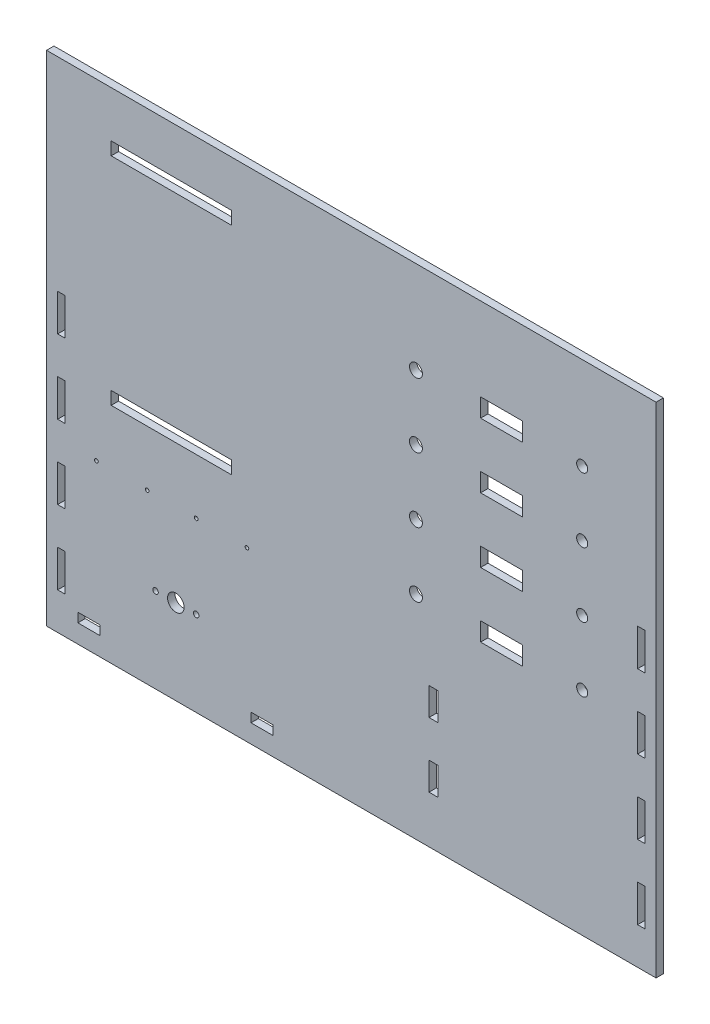
from build123d import *

# Parameters (mm, degrees)
SCHIZZO1_W                   = 330
SCHIZZO1_H                   = 270
SCHIZZO1_R                   = 3.5
SCHIZZO1_R_2                 = 1
SCHIZZO1_R_3                 = 3
SCHIZZO1_R_4                 = 4.5
SCHIZZO1_R_5                 = 1.5
SCHIZZO1_W_2                 = 22.7
SCHIZZO1_H_2                 = 10
SCHIZZO1_W_3                 = 65
SCHIZZO1_H_3                 = 7
SCHIZZO1_W_4                 = 4
SCHIZZO1_H_4                 = 20
SCHIZZO1_W_5                 = 5
SCHIZZO1_H_5                 = 15
SCHIZZO1_W_6                 = 12
SCHIZZO1_H_6                 = 5
ESTRUSIONE_ESTRUSIONE1_DEPTH = 4


with BuildPart() as part:
    # Schizzo1 → Estrusione-Estrusione1 (new body)
    with BuildSketch(Plane.XY):
        with Locations((165, 135)):
            Rectangle(SCHIZZO1_W, SCHIZZO1_H)
        with Locations((200, 220)):
            Circle(SCHIZZO1_R, mode=Mode.SUBTRACT)
        with Locations((200, 185)):
            Circle(SCHIZZO1_R, mode=Mode.SUBTRACT)
        with Locations((200, 150)):
            Circle(SCHIZZO1_R, mode=Mode.SUBTRACT)
        with Locations((200, 115)):
            Circle(SCHIZZO1_R, mode=Mode.SUBTRACT)
        with Locations((27, 91)):
            Circle(SCHIZZO1_R_2, mode=Mode.SUBTRACT)
        with Locations((54.5, 91)):
            Circle(SCHIZZO1_R_2, mode=Mode.SUBTRACT)
        with Locations((81, 91)):
            Circle(SCHIZZO1_R_2, mode=Mode.SUBTRACT)
        with Locations((108.5, 91)):
            Circle(SCHIZZO1_R_2, mode=Mode.SUBTRACT)
        with Locations((290, 220)):
            Circle(SCHIZZO1_R_3, mode=Mode.SUBTRACT)
        with Locations((290, 185)):
            Circle(SCHIZZO1_R_3, mode=Mode.SUBTRACT)
        with Locations((290, 150)):
            Circle(SCHIZZO1_R_3, mode=Mode.SUBTRACT)
        with Locations((290, 115)):
            Circle(SCHIZZO1_R_3, mode=Mode.SUBTRACT)
        with Locations((70, 46)):
            Circle(SCHIZZO1_R_4, mode=Mode.SUBTRACT)
        with Locations((59, 46)):
            Circle(SCHIZZO1_R_5, mode=Mode.SUBTRACT)
        with Locations((81, 46)):
            Circle(SCHIZZO1_R_5, mode=Mode.SUBTRACT)
        with Locations((246.35, 185)):
            Rectangle(SCHIZZO1_W_2, SCHIZZO1_H_2, mode=Mode.SUBTRACT)
        with Locations((67.5, 241.5)):
            Rectangle(SCHIZZO1_W_3, SCHIZZO1_H_3, mode=Mode.SUBTRACT)
        with Locations((246.35, 220)):
            Rectangle(SCHIZZO1_W_2, SCHIZZO1_H_2, mode=Mode.SUBTRACT)
        with Locations((246.35, 150)):
            Rectangle(SCHIZZO1_W_2, SCHIZZO1_H_2, mode=Mode.SUBTRACT)
        with Locations((246.35, 115)):
            Rectangle(SCHIZZO1_W_2, SCHIZZO1_H_2, mode=Mode.SUBTRACT)
        with Locations((8, 110)):
            Rectangle(SCHIZZO1_W_4, SCHIZZO1_H_4, mode=Mode.SUBTRACT)
        with Locations((67.5, 124.5)):
            Rectangle(SCHIZZO1_W_3, SCHIZZO1_H_3, mode=Mode.SUBTRACT)
        with Locations((209.563268788, 68.177868744)):
            Rectangle(SCHIZZO1_W_5, SCHIZZO1_H_5, mode=Mode.SUBTRACT)
        with Locations((22.947077827, 12.5)):
            Rectangle(SCHIZZO1_W_6, SCHIZZO1_H_6, mode=Mode.SUBTRACT)
        with Locations((116.687234465, 12.5)):
            Rectangle(SCHIZZO1_W_6, SCHIZZO1_H_6, mode=Mode.SUBTRACT)
        with Locations((209.563268788, 33.177868744)):
            Rectangle(SCHIZZO1_W_5, SCHIZZO1_H_5, mode=Mode.SUBTRACT)
        with Locations((8, 150)):
            Rectangle(SCHIZZO1_W_4, SCHIZZO1_H_4, mode=Mode.SUBTRACT)
        with Locations((8, 70)):
            Rectangle(SCHIZZO1_W_4, SCHIZZO1_H_4, mode=Mode.SUBTRACT)
        with Locations((8, 30)):
            Rectangle(SCHIZZO1_W_4, SCHIZZO1_H_4, mode=Mode.SUBTRACT)
        with Locations((322, 110)):
            Rectangle(SCHIZZO1_W_4, SCHIZZO1_H_4, mode=Mode.SUBTRACT)
        with Locations((322, 150)):
            Rectangle(SCHIZZO1_W_4, SCHIZZO1_H_4, mode=Mode.SUBTRACT)
        with Locations((322, 70)):
            Rectangle(SCHIZZO1_W_4, SCHIZZO1_H_4, mode=Mode.SUBTRACT)
        with Locations((322, 30)):
            Rectangle(SCHIZZO1_W_4, SCHIZZO1_H_4, mode=Mode.SUBTRACT)
    extrude(amount=ESTRUSIONE_ESTRUSIONE1_DEPTH)


solid = part.part
